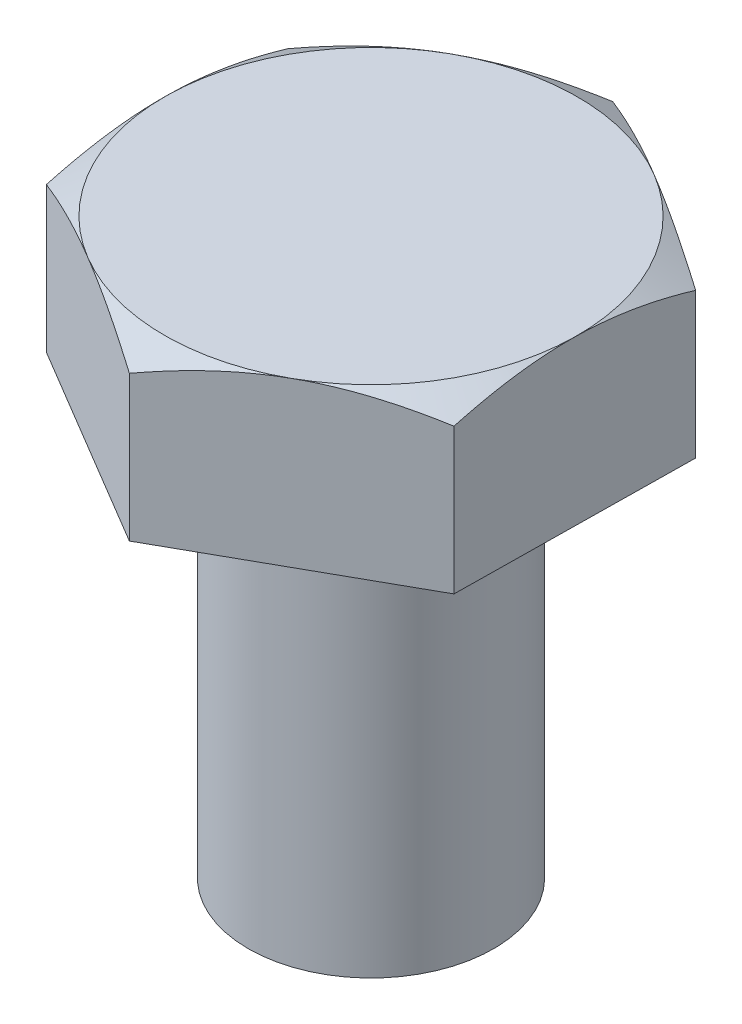
from build123d import *

# Parameters (mm, degrees)
SKETCH1_R           = 3
BOSS_EXTRUDE1_DEPTH = 10
BOSS_EXTRUDE2_DEPTH = 4
SKETCH3_OUTSIDE_W   = 64.838
SKETCH3_OUTSIDE_H   = 66.322
SKETCH3_OUTSIDE_R   = 5.046144313
CUT_EXTRUDE10_DEPTH = 14
CUT_EXTRUDE10_DRAFT = -60


with BuildPart() as part:
    # Sketch1 → Boss-Extrude1 (new body)
    with BuildSketch(Plane(origin=(0, 0, 0), x_dir=(1, 0, 0), z_dir=(0, 1, 0))):
        with Locations(Location((0, 0, 0), (0, 0, 270))):
            Circle(SKETCH1_R)
    extrude(amount=-BOSS_EXTRUDE1_DEPTH)


with BuildPart() as body_2:
    # Sketch2 → Boss-Extrude2 (new body)
    with BuildSketch(Plane(origin=(0, 0, 0), x_dir=(1, 0, 0), z_dir=(0, 1, 0))):
        Polygon((5.084186, 2.846486013), (0.076963801, 5.82627724), (-5.007222199, 2.979791227), (-5.084186, -2.846486013), (-0.076963801, -5.82627724), (5.007222199, -2.979791227), align=None)
    extrude(amount=BOSS_EXTRUDE2_DEPTH)


with BuildPart() as cut_extrude10_tool:
    # Sketch3 outside → Cut-Extrude10 (with draft: the straight prism first)
    with BuildSketch(Plane(origin=(0, 4, 0), x_dir=(1, 0, 0), z_dir=(0, 1, 0))):
        Rectangle(SKETCH3_OUTSIDE_W, SKETCH3_OUTSIDE_H)
        Circle(SKETCH3_OUTSIDE_R, mode=Mode.SUBTRACT)
    extrude(amount=-CUT_EXTRUDE10_DEPTH)
    # Cut-Extrude10: the draft: its side faces are tilted about the plane it starts from
    cut_extrude10_sides = [cut_extrude10_tool.faces().sort_by_distance(p)[0] for p in [
        (0, -3, 33.161),
        (32.419, -3, 0),
        (0, -3, -33.161),
        (-32.419, -3, 0),
        (-5.046144313, -3, 0),
    ]]
    draft(cut_extrude10_sides, Plane(origin=(0, 4, 0), x_dir=(1, 0, 0), z_dir=(0, 1, 0)), CUT_EXTRUDE10_DRAFT)


with BuildPart() as body_2_1:
    add(body_2.part)

    # Cut-Extrude10: cut by cut_extrude10_tool
    add(cut_extrude10_tool.part, mode=Mode.SUBTRACT)


solid = Compound([part.part, body_2_1.part])
